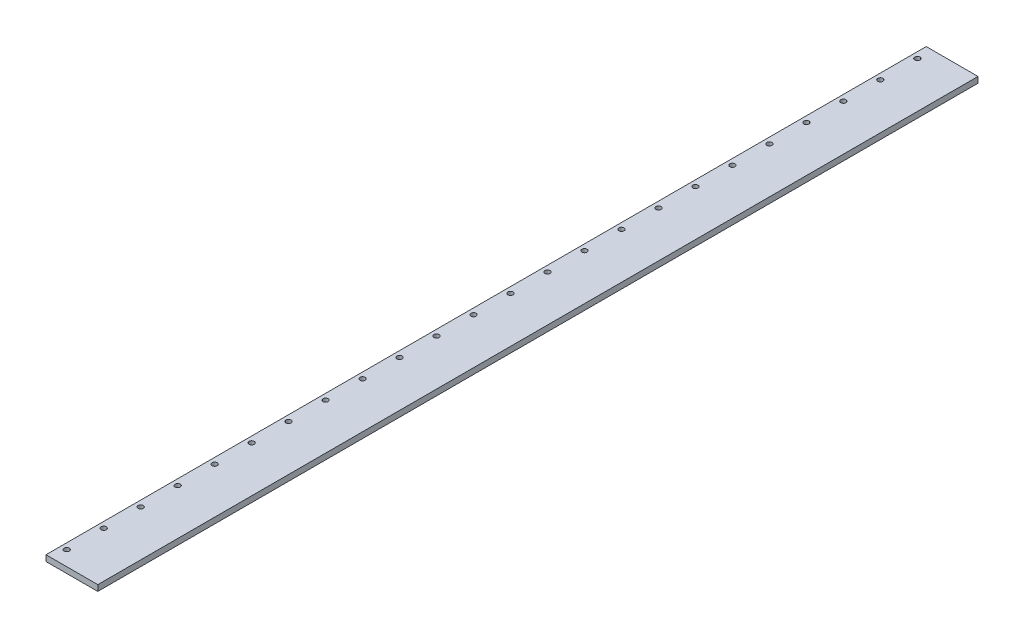
from build123d import *

# Parameters (mm, degrees)
SKETCH1_W           = 35
SKETCH1_H           = 4
BOSS_EXTRUDE2_DEPTH = 595
SKETCH2_R           = 1.75
CUT_EXTRUDE1_DEPTH  = 596.270736724
LPATTERN1_COUNT     = 24
LPATTERN1_PITCH     = 25


with BuildPart() as part:
    # Sketch1 → Boss-Extrude2 (new body)
    with BuildSketch(Plane.XY):
        Rectangle(SKETCH1_W, SKETCH1_H)
    extrude(amount=BOSS_EXTRUDE2_DEPTH)

    # Sketch2 → Cut-Extrude1 (cut, through all)
    with BuildSketch(Plane(origin=(0, 2, 0), x_dir=(1, 0, 0), z_dir=(0, 1, 0))):
        with Locations(Location((-13.5, -10, 0), (0, 0, 180))):
            Circle(SKETCH2_R)
    cut_extrude1 = extrude(amount=-CUT_EXTRUDE1_DEPTH, mode=Mode.SUBTRACT)

    # LPattern1: Cut-Extrude1 ×24
    with Locations(*[(0, 0, i * LPATTERN1_PITCH) for i in range(1, LPATTERN1_COUNT)]):
        add(cut_extrude1, mode=Mode.SUBTRACT)


solid = part.part
